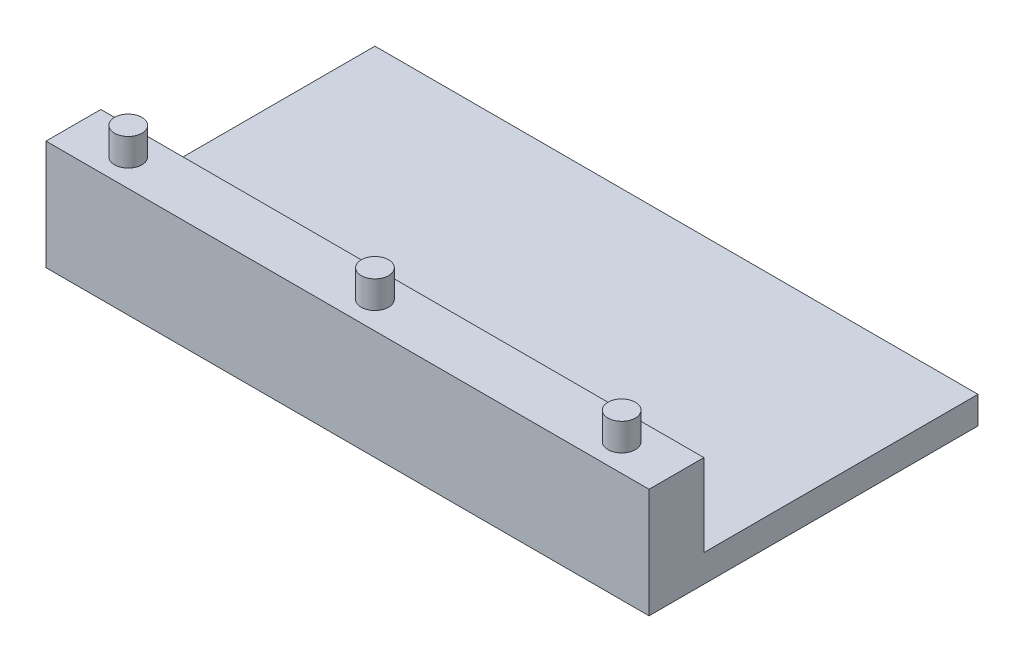
from build123d import *

# Parameters (mm, degrees)
SKETCH1_W           = 139.7
SKETCH1_H           = 76.2
BOSS_EXTRUDE1_DEPTH = 6.35
SKETCH2_W           = 139.7
SKETCH2_H           = 12.7
BOSS_EXTRUDE2_DEPTH = 19.05
SKETCH3_R           = 2.032
CUT_EXTRUDE1_DEPTH  = 82.814026915
CUT_EXTRUDE2_DEPTH  = 3.048
SKETCH5_R           = 3.175
BOSS_EXTRUDE3_DEPTH = 6.35


with BuildPart() as part:
    # Sketch1 → Boss-Extrude1 (new body)
    with BuildSketch(Plane(origin=(0, 0, 0), x_dir=(1, 0, 0), z_dir=(0, 1, 0))):
        Rectangle(SKETCH1_W, SKETCH1_H)
    extrude(amount=BOSS_EXTRUDE1_DEPTH)

    # Sketch2 → Boss-Extrude2 (add)
    with BuildSketch(Plane(origin=(0, 6.35, 0), x_dir=(1, 0, 0), z_dir=(0, 1, 0))):
        with Locations((0, -31.75)):
            Rectangle(SKETCH2_W, SKETCH2_H)
    extrude(amount=BOSS_EXTRUDE2_DEPTH)

    # Sketch3 → Cut-Extrude1 (cut, through all)
    with BuildSketch(Plane(origin=(0, 6.35, 0), x_dir=(1, 0, 0), z_dir=(0, 1, 0))):
        with Locations(Location((-53.34, -21.59, 0), (0, 0, 270))):
            Circle(SKETCH3_R)
    extrude(amount=-CUT_EXTRUDE1_DEPTH, mode=Mode.SUBTRACT)

    # Sketch4 → Cut-Extrude2 (cut)
    with BuildSketch(Plane.XZ):
        Polygon((-50.927, 25.769438599), (-55.753, 25.769438599), (-58.166, 21.59), (-55.753, 17.410561401), (-50.927, 17.410561401), (-48.514, 21.59), align=None)
    extrude(amount=-CUT_EXTRUDE2_DEPTH, mode=Mode.SUBTRACT)

    # Sketch5 → Boss-Extrude3 (add)
    with BuildSketch(Plane(origin=(0, 25.4, 0), x_dir=(1, 0, 0), z_dir=(0, 1, 0))):
        with Locations(Location((-57.15, -31.75, 0), (0, 0, 270))):
            Circle(SKETCH5_R)
        with Locations(Location((0, -31.75, 0), (0, 0, 270))):
            Circle(SKETCH5_R)
        with Locations(Location((57.15, -31.75, 0), (0, 0, 270))):
            Circle(SKETCH5_R)
    extrude(amount=BOSS_EXTRUDE3_DEPTH)


solid = part.part
